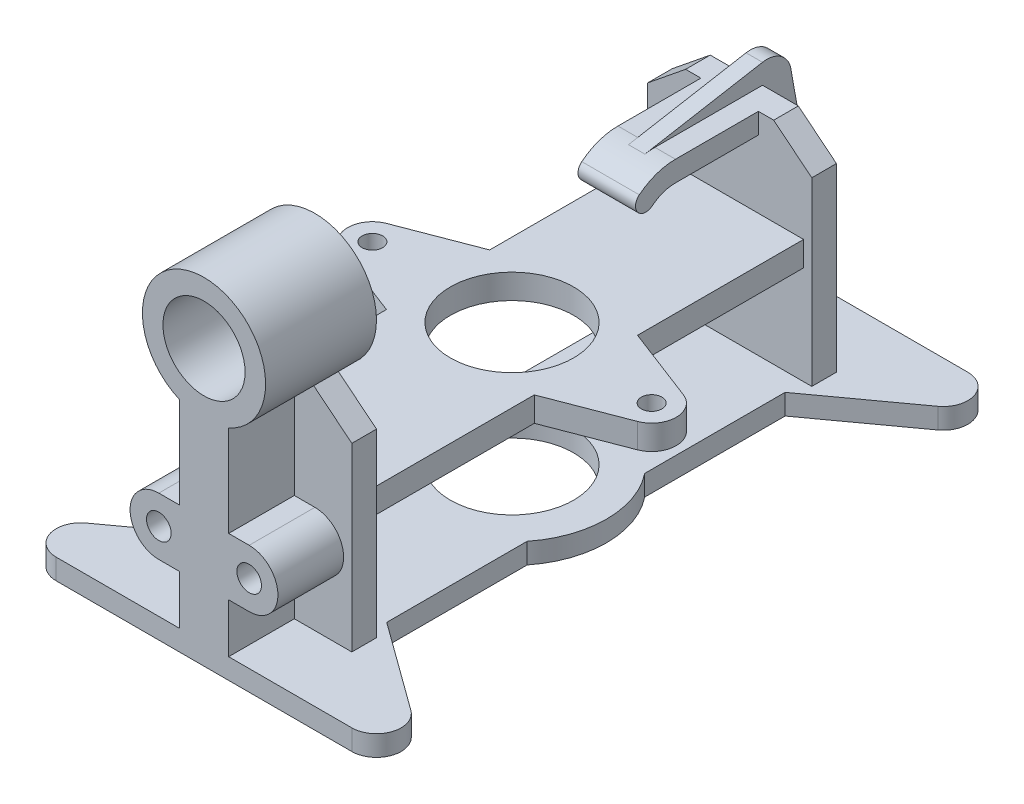
from build123d import *

# Parameters (mm, degrees)
SKETCH1_R            = 15
BOSS_EXTRUDE1_DEPTH  = 5
SKETCH2_R            = 15
SKETCH2_R_2          = 10
BOSS_EXTRUDE2_DEPTH  = 27
SKETCH4_R            = 3
BOSS_EXTRUDE19_DEPTH = 16
BOSS_EXTRUDE20_DEPTH = 6
LPATTERN1_COUNT      = 2
LPATTERN1_PITCH      = 112
BOSS_EXTRUDE21_START = -6
BOSS_EXTRUDE21_DEPTH = 6
BOSS_EXTRUDE22_START = 24
SKETCH8_R            = 2.5
SKETCH8_R_2          = 15
BOSS_EXTRUDE22_DEPTH = 6
BOSS_EXTRUDE23_DEPTH = 7
BOSS_EXTRUDE24_DEPTH = 2


with BuildPart() as part:
    # Sketch1 → Boss-Extrude1 (new body)
    with BuildSketch(Plane(origin=(0, 0, 0), x_dir=(1, 0, 0), z_dir=(0, 1, 0))):
        with BuildLine():
            Line((-18, 48.505826631), (-18, 14.317821063))
            ThreePointArc((-18, 14.317821063), (-23, 0), (-18, -14.317821063))
            Line((-18, -14.317821063), (-18, -48.505826631))
            Line((-18, -48.505826631), (-39.526711514, -64.145898034))
            ThreePointArc((-39.526711514, -64.145898034), (-41.706339098, -70.854101966), (-36, -75))
            Line((-36, -75), (36, -75))
            ThreePointArc((36, -75), (41.706339098, -70.854101966), (39.526711514, -64.145898034))
            Line((39.526711514, -64.145898034), (18, -48.505826631))
            Line((18, -48.505826631), (18, -14.317821063))
            ThreePointArc((18, -14.317821063), (23, 0), (18, 14.317821063))
            Line((18, 14.317821063), (18, 48.505826631))
            Line((18, 48.505826631), (39.526711514, 64.145898034))
            ThreePointArc((39.526711514, 64.145898034), (41.706339098, 70.854101966), (36, 75))
            Line((36, 75), (-36, 75))
            ThreePointArc((-36, 75), (-41.706339098, 70.854101966), (-39.526711514, 64.145898034))
            Line((-39.526711514, 64.145898034), (-18, 48.505826631))
        make_face()
        with Locations(Location((0, 0, 0), (0, 0, 270))):
            Circle(SKETCH1_R, mode=Mode.SUBTRACT)
    extrude(amount=BOSS_EXTRUDE1_DEPTH)



with BuildPart() as body_2:
    # Sketch2 → Boss-Extrude2 (new body)
    with BuildSketch(Plane.XY.offset(75)):
        with Locations((0, 67)):
            Circle(SKETCH2_R)
        with Locations((0, 67)):
            Circle(SKETCH2_R_2, mode=Mode.SUBTRACT)
    extrude(amount=-BOSS_EXTRUDE2_DEPTH)


with BuildPart() as part_1:
    add(part.part)

    add(body_2.part)  # Boss-Extrude19 merges body 2
    # Sketch4 → Boss-Extrude19 (add)
    with BuildSketch(Plane.XY.offset(75)):
        with BuildLine():
            Line((-6, 53.252272915), (-6, 31))
            Line((-6, 31), (-11, 31))
            ThreePointArc((-11, 31), (-18, 24), (-11, 17))
            Line((-11, 17), (-6, 17))
            Line((-6, 17), (-6, 5))
            Line((-6, 5), (6, 5))
            Line((6, 5), (6, 17))
            Line((6, 17), (11, 17))
            ThreePointArc((11, 17), (18, 24), (11, 31))
            Line((11, 31), (6, 31))
            Line((6, 31), (6, 53.252272915))
            ThreePointArc((6, 53.252272915), (0, 52), (-6, 53.252272915))
        make_face()
        with Locations((-11, 24)):
            Circle(SKETCH4_R, mode=Mode.SUBTRACT)
        with Locations((11, 24)):
            Circle(SKETCH4_R, mode=Mode.SUBTRACT)
    extrude(amount=-BOSS_EXTRUDE19_DEPTH)

    # Sketch5 → Boss-Extrude20 (add)
    with BuildSketch(Plane(origin=(0, 0, 59), x_dir=(-1, 0, 0), z_dir=(0, 0, -1))):
        with BuildLine():
            Line((-20, 5), (-20, 49))
            Line((-20, 49), (-10.723697691, 56.511801497))
            ThreePointArc((-10.723697691, 56.511801497), (0, 52), (10.723697691, 56.511801497))
            Line((10.723697691, 56.511801497), (20, 49))
            Line((20, 49), (20, 5))
            Line((20, 5), (-20, 5))
        make_face()
    boss_extrude20 = extrude(amount=BOSS_EXTRUDE20_DEPTH)

    # LPattern1: Boss-Extrude20 ×2
    with Locations(*[(0, 0, -i * LPATTERN1_PITCH) for i in range(1, LPATTERN1_COUNT)]):
        add(boss_extrude20)

    # Sketch7 → Boss-Extrude21 (add)
    with BuildSketch(Plane(origin=(0, 0, -59), x_dir=(-1, 0, 0), z_dir=(0, 0, -1)).offset(BOSS_EXTRUDE21_START)):
        with BuildLine():
            Line((-10.723697691, 56.511801497), (10.723697691, 56.511801497))
            ThreePointArc((10.723697691, 56.511801497), (0, 52), (-10.723697691, 56.511801497))
        make_face()
    extrude(amount=BOSS_EXTRUDE21_DEPTH)

    # Sketch8 → Boss-Extrude22 (add)
    with BuildSketch(Plane(origin=(0, 5, 0), x_dir=(1, 0, 0), z_dir=(0, 1, 0)).offset(BOSS_EXTRUDE22_START)):
        with BuildLine():
            Line((-36.150207697, 5.601482559), (-18, 12.568694522))
            Line((-18, 12.568694522), (-18, 53))
            Line((-18, 53), (18, 53))
            Line((18, 53), (18, 12.568694522))
            Line((18, 12.568694522), (36.150207697, 5.601482559))
            ThreePointArc((36.150207697, 5.601482559), (40, 0), (36.150207697, -5.601482559))
            Line((36.150207697, -5.601482559), (18, -12.568694522))
            Line((18, -12.568694522), (18, -53))
            Line((18, -53), (15, -53))
            Line((15, -53), (15, -48))
            Line((15, -48), (-15, -48))
            Line((-15, -48), (-15, -53))
            Line((-15, -53), (-18, -53))
            Line((-18, -53), (-18, -12.568694522))
            Line((-18, -12.568694522), (-36.150207697, -5.601482559))
            ThreePointArc((-36.150207697, -5.601482559), (-40, 0), (-36.150207697, 5.601482559))
        make_face()
        with Locations(Location((-34, 0, 0), (0, 0, 270))):
            Circle(SKETCH8_R, mode=Mode.SUBTRACT)
        with Locations(Location((34, 0, 0), (0, 0, 270))):
            Circle(SKETCH8_R, mode=Mode.SUBTRACT)
        with Locations(Location((0, 0, 0), (0, 0, 270))):
            Circle(SKETCH8_R_2, mode=Mode.SUBTRACT)
    extrude(amount=BOSS_EXTRUDE22_DEPTH)

    # Sketch9 → Boss-Extrude23 (add, symmetric)
    with BuildSketch(Plane(origin=(0, 0, 0), x_dir=(0, 0, -1), z_dir=(1, 0, 0))):
        with BuildLine():
            Line((53, 51.511801497), (32.799551055, 51.511801497))
            ThreePointArc((32.799551055, 51.511801497), (29.799551055, 50.997082871), (27.142696805, 49.511801497))
            ThreePointArc((27.142696805, 49.511801497), (23.626903958, 49.884897539), (24, 53.400690386))
            ThreePointArc((24, 53.400690386), (28.132884388, 55.711128079), (32.799551055, 56.511801497))
            Line((32.799551055, 56.511801497), (53, 56.511801497))
            Line((53, 56.511801497), (53, 51.511801497))
        make_face()
    extrude(amount=BOSS_EXTRUDE23_DEPTH, both=True)

    # Sketch10 → Boss-Extrude24 (add, symmetric)
    with BuildSketch(Plane(origin=(0, 0, 0), x_dir=(0, 0, -1), z_dir=(1, 0, 0))):
        with BuildLine():
            Line((75, 5), (64.145898034, 5))
            Line((64.145898034, 5), (59, 5))
            Line((59, 5), (59, 49))
            Line((59, 49), (59, 56.511801497))
            Line((59, 56.511801497), (53, 56.511801497))
            Line((53, 56.511801497), (32.799551055, 56.511801497))
            ThreePointArc((32.799551055, 56.511801497), (31.5778479, 56.458393963), (30.365465911, 56.29857884))
            Line((30.365465911, 56.29857884), (59, 61.35406732))
            ThreePointArc((59, 61.35406732), (63.46156073, 60.365729702), (65.917079571, 56.511801497))
            Line((65.917079571, 56.511801497), (75, 5))
        make_face()
    extrude(amount=BOSS_EXTRUDE24_DEPTH, both=True)


solid = part_1.part
